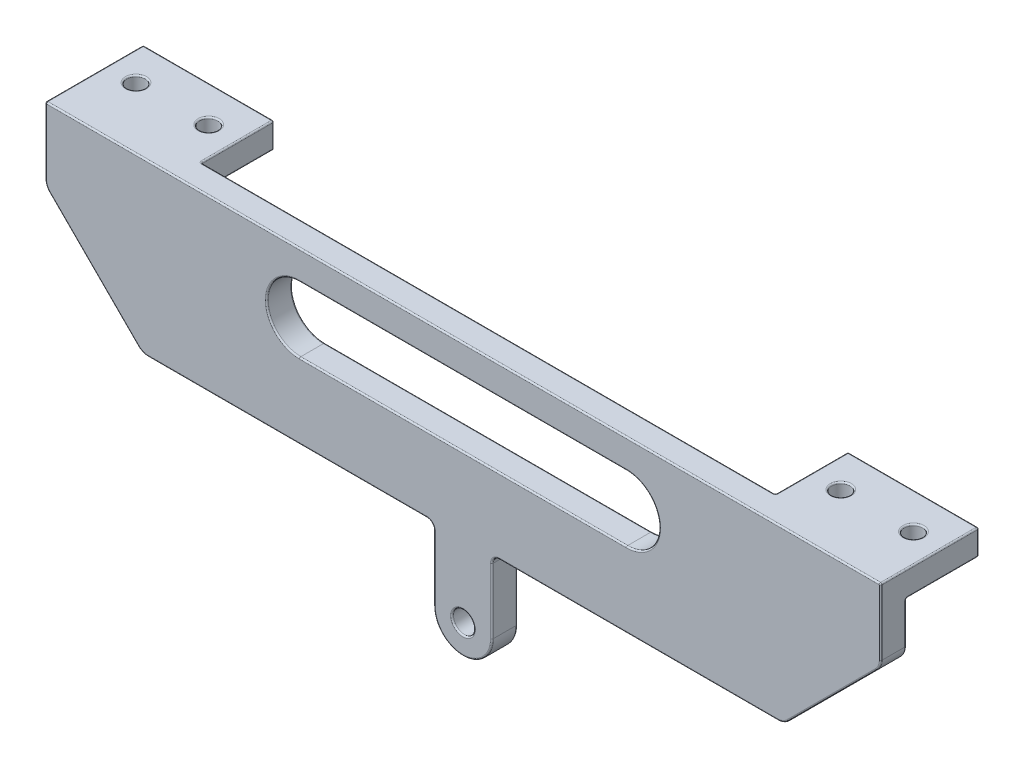
from build123d import *

# Parameters (mm, degrees)
SKETCH4_R           = 1.5
BOSS_EXTRUDE1_DEPTH = 3.5
SKETCH5_W           = 18
SKETCH5_H           = 10
SKETCH5_R           = 1.25
BOSS_EXTRUDE2_DEPTH = 3.5
FILLET1_R           = 2
FILLET2_R           = 1
FILLET3_R           = 0.2


with BuildPart() as part:
    # Sketch4 → Boss-Extrude1 (new body)
    with BuildSketch(Plane.XY):
        with BuildLine():
            Line((-57.5, 93.357864376), (57.5, 93.357864376))
            Line((57.5, 93.357864376), (57.5, 83.357864376))
            Line((57.5, 83.357864376), (44.142135624, 70))
            Line((44.142135624, 70), (4, 70))
            Line((4, 70), (4, 60))
            ThreePointArc((4, 60), (0, 56), (-4, 60))
            Line((-4, 60), (-4, 70))
            Line((-4, 70), (-44.142135624, 70))
            Line((-44.142135624, 70), (-57.5, 83.357864376))
            Line((-57.5, 83.357864376), (-57.5, 93.357864376))
        make_face()
        with Locations((0, 60)):
            Circle(SKETCH4_R, mode=Mode.SUBTRACT)
        with BuildLine():
            Line((-22.5, 89.357864376), (22.5, 89.357864376))
            ThreePointArc((22.5, 89.357864376), (27, 84.857864376), (22.5, 80.357864376))
            Line((22.5, 80.357864376), (-22.5, 80.357864376))
            ThreePointArc((-22.5, 80.357864376), (-27, 84.857864376), (-22.5, 89.357864376))
        make_face(mode=Mode.SUBTRACT)
    extrude(amount=BOSS_EXTRUDE1_DEPTH)

    # Sketch5 → Boss-Extrude2 (add)
    # profile 1 of 2: a face of its own
    with BuildSketch(Plane(origin=(0, 93.357864376, 0), x_dir=(1, 0, 0), z_dir=(0, 1, 0))):
        with Locations((-48.5, 5)):
            Rectangle(SKETCH5_W, SKETCH5_H)
        with Locations(Location((-53.5, 5, 0), (0, 0, 270))):
            Circle(SKETCH5_R, mode=Mode.SUBTRACT)
        with Locations(Location((-43.5, 5, 0), (0, 0, 270))):
            Circle(SKETCH5_R, mode=Mode.SUBTRACT)
    # profile 2 of 2: a face of its own
    with BuildSketch(Plane(origin=(0, 93.357864376, 0), x_dir=(1, 0, 0), z_dir=(0, 1, 0))):
        with Locations((48.5, 5)):
            Rectangle(SKETCH5_W, SKETCH5_H)
        with Locations(Location((43.5, 5, 0), (0, 0, 90))):
            Circle(SKETCH5_R, mode=Mode.SUBTRACT)
        with Locations(Location((53.5, 5, 0), (0, 0, 90))):
            Circle(SKETCH5_R, mode=Mode.SUBTRACT)
    extrude(amount=-BOSS_EXTRUDE2_DEPTH)

    # Fillet1
    fillet1_edges = [part.edges().sort_by_distance(p)[0] for p in [
        (57.5, 83.357864376, 1.75),
        (44.142135624, 70, 1.75),
        (-44.142135624, 70, 1.75),
        (-57.5, 83.357864376, 1.75),
    ]]
    fillet(fillet1_edges, radius=FILLET1_R)

    # Fillet2
    fillet2_edges = [part.edges().sort_by_distance(p)[0] for p in [
        (4, 70, 1.75),
        (-4, 70, 1.75),
    ]]
    fillet(fillet2_edges, radius=FILLET2_R)

    # Fillet3
    fillet3_edges = [part.edges().sort_by_distance(p)[0] for p in [
        (-4, 64.5, 0),
        (-4, 64.5, 3.5),
        (24.156854249, 70, 0),
        (24.156854249, 70, 3.5),
        (-4.292893219, 69.707106781, 0),
        (-4.292893219, 69.707106781, 3.5),
        (4.292893219, 69.707106781, 0),
        (4.292893219, 69.707106781, 3.5),
        (4, 64.5, 0),
        (0, 56, 0),
        (-57.5, 93.357864376, -3.25),
        (57.5, 93.357864376, -3.25),
        (0, 56, 3.5),
        (4, 64.5, 3.5),
        (-1.5, 60, 0),
        (-1.5, 60, 3.5),
        (-27, 84.857864376, 0),
        (0, 80.357864376, 0),
        (27, 84.857864376, 0),
        (0, 89.357864376, 0),
        (-27, 84.857864376, 3.5),
        (0, 80.357864376, 3.5),
        (27, 84.857864376, 3.5),
        (0, 89.357864376, 3.5),
        (0, 93.357864376, 3.5),
        (-57.5, 87.022077939, 0),
        (-57.5, 88.772077939, 3.5),
        (-57.5, 89.857864376, -5),
        (-48.5, 89.857864376, -10),
        (-57.5, 91.607864376, -10),
        (-39.5, 89.857864376, -5),
        (-39.5, 91.607864376, -10),
        (-48.5, 89.857864376, 0),
        (-39.5, 91.607864376, 0),
        (-43.5, 89.857864376, -6.25),
        (-53.5, 89.857864376, -6.25),
        (-39.5, 93.357864376, -5),
        (-48.5, 93.357864376, -10),
        (-53.5, 93.357864376, -6.25),
        (-43.5, 93.357864376, -6.25),
        (0, 93.357864376, 0),
        (48.5, 89.857864376, 0),
        (39.5, 89.857864376, -5),
        (39.5, 91.607864376, 0),
        (48.5, 89.857864376, -10),
        (39.5, 91.607864376, -10),
        (57.5, 89.857864376, -5),
        (57.5, 91.607864376, -10),
        (53.5, 89.857864376, -3.75),
        (43.5, 89.857864376, -3.75),
        (48.5, 93.357864376, -10),
        (39.5, 93.357864376, -5),
        (43.5, 93.357864376, -3.75),
        (53.5, 93.357864376, -3.75),
        (57.5, 87.022077939, 0),
        (57.5, 88.772077939, 3.5),
        (50.821067812, 76.678932188, 0),
        (-24.156854249, 70, 0),
        (-50.821067812, 76.678932188, 0),
        (-57.347759065, 83.420924636, 0),
        (-44.079075364, 70.152240935, 0),
        (44.079075364, 70.152240935, 0),
        (57.347759065, 83.420924636, 0),
        (50.821067812, 76.678932188, 3.5),
        (-50.821067812, 76.678932188, 3.5),
        (-24.156854249, 70, 3.5),
        (-57.347759065, 83.420924636, 3.5),
        (-44.079075364, 70.152240935, 3.5),
        (44.079075364, 70.152240935, 3.5),
        (57.347759065, 83.420924636, 3.5),
    ]]
    fillet(fillet3_edges, radius=FILLET3_R)


solid = part.part
